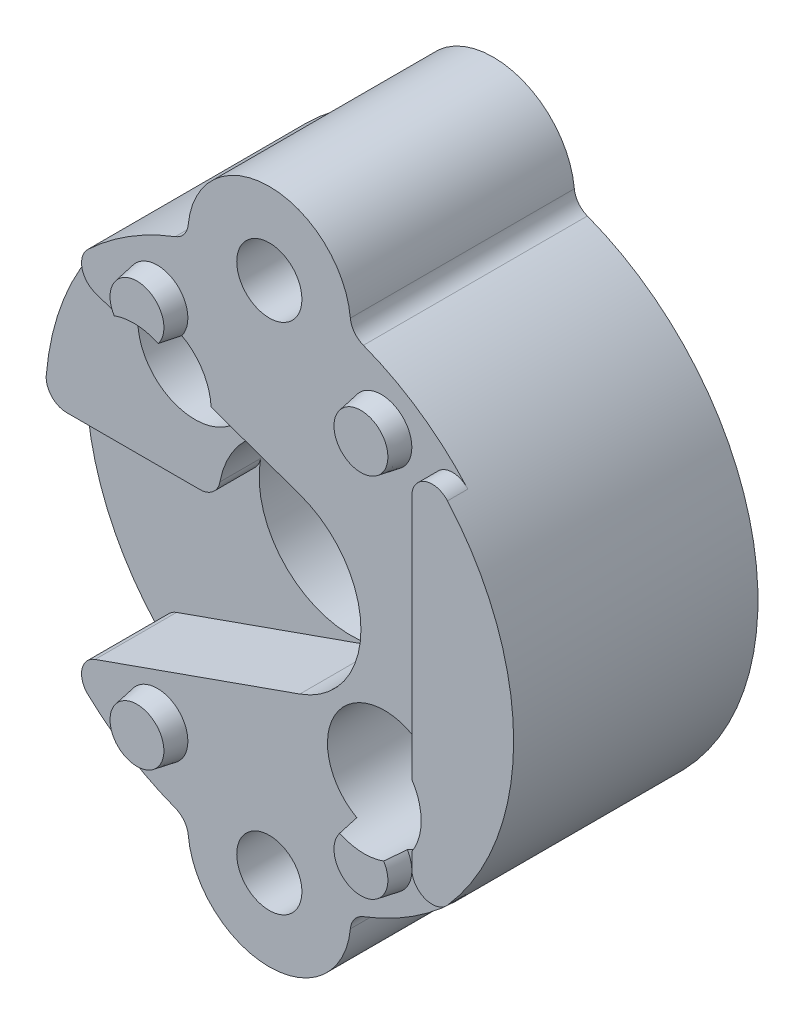
from build123d import *

# Parameters (mm, degrees)
SKETCH1_R                     = 4.5
BOSS_EXTRUDE1_DEPTH           = 11
CUT_EXTRUDE1_START            = -2
CUT_EXTRUDE1_DEPTH            = 2
SKETCH3_R                     = 1.4999999999999996
BOSS_EXTRUDE2_DEPTH           = 1
BOSS_EXTRUDE2_DRAFT           = 10.000000000000021
BOSS_EXTRUDE2_PROFILE_2_DEPTH = 1
BOSS_EXTRUDE2_PROFILE_2_DRAFT = 10.000000000000021
BOSS_EXTRUDE2_PROFILE_3_DEPTH = 1
BOSS_EXTRUDE2_PROFILE_3_DRAFT = 10.000000000000021
SKETCH3_R_2                   = 1.5000000000000002
BOSS_EXTRUDE2_PROFILE_4_DEPTH = 1
BOSS_EXTRUDE2_PROFILE_4_DRAFT = 10.000000000000021
SKETCH4_R                     = 1.5999999999999999
CUT_EXTRUDE2_DEPTH            = 24.7815054191277
CUT_EXTRUDE3_DEPTH            = 24.7815054191277
CUT_EXTRUDE3_DEPTH_BACK       = 5
SKETCH5_R                     = 2.7999999999999994
SKETCH5_R_2                   = 2.8
CUT_EXTRUDE4_DEPTH            = 3
CUT_EXTRUDE5_START            = -2
CUT_EXTRUDE5_DEPTH            = 2
BOSS_EXTRUDE3_DEPTH           = 1
CUT_EXTRUDE6_DEPTH            = 1
FILLET1_R                     = 1
CUT_EXTRUDE7_DEPTH            = 2


with BuildPart() as part:
    # Sketch1 → Boss-Extrude1 (new body)
    with BuildSketch(Plane.XY):
        with BuildLine():
            ThreePointArc((3.993464047921404, -12.371428571428574), (13.000000000000002, 0), (3.9934640479214014, 12.371428571428574))
            ThreePointArc((3.9934640479214014, 12.371428571428574), (2.9081167199998763, 15.346426249302382), (-4.07e-15, 16.6))
            ThreePointArc((-4.07e-15, 16.6), (-2.908116719999883, 15.346426249302382), (-3.9934640479214067, 12.371428571428574))
            ThreePointArc((-3.9934640479214067, 12.371428571428574), (-13.000000000000002, 1.59e-15), (-3.993464047921404, -12.371428571428574))
            ThreePointArc((-3.993464047921404, -12.371428571428574), (-2.90811671999988, -15.346426249302382), (0, -16.6))
            ThreePointArc((0, -16.6), (2.90811671999988, -15.346426249302382), (3.993464047921404, -12.371428571428574))
        make_face()
        Circle(SKETCH1_R, mode=Mode.SUBTRACT)
        with BuildLine():
            ThreePointArc((1.5870475987269075, -12.396825396825397), (4.5e-16, -11), (-1.587047598726907, -12.396825396825397))
            ThreePointArc((-1.587047598726907, -12.396825396825397), (-2.6e-16, -14.2), (1.5870475987269075, -12.396825396825397))
        make_face(mode=Mode.SUBTRACT)
        with BuildLine():
            ThreePointArc((-1.5870475987270802, 12.396825396825376), (-4.89e-15, 10.99999999999983), (1.5870475987267345, 12.396825396825419))
            ThreePointArc((1.5870475987267345, 12.396825396825419), (-2.28e-15, 14.199999999999829), (-1.5870475987270802, 12.396825396825376))
        make_face(mode=Mode.SUBTRACT)
    extrude(amount=BOSS_EXTRUDE1_DEPTH)

    # Sketch2 → Cut-Extrude1 (cut)
    with BuildSketch(Plane.XY.offset(11).offset(CUT_EXTRUDE1_START)):
        with BuildLine():
            Line((-9.998792207106897, -8.30807765966944), (1.5, -4.242640687119285))
            Line((1.5, -4.242640687119285), (1.5, 4.242640687119285))
            Line((1.5, 4.242640687119285), (-9.998792207106897, 8.30807765966944))
            ThreePointArc((-9.998792207106897, 8.30807765966944), (-13.000000000000002, 1.59e-15), (-9.998792207106897, -8.30807765966944))
        make_face()
    extrude(amount=CUT_EXTRUDE1_DEPTH, mode=Mode.SUBTRACT)


with BuildPart() as boss_extrude2_tool:
    # Sketch3 → Boss-Extrude2 (with draft: the straight prism first)
    with BuildSketch(Plane.XY.offset(11)):
        with Locations((-5.5, -9)):
            Circle(SKETCH3_R)
    extrude(amount=BOSS_EXTRUDE2_DEPTH)
    # Boss-Extrude2: the draft: its side faces are tilted about the plane it starts from
    boss_extrude2_sides = [boss_extrude2_tool.faces().sort_by_distance(p)[0] for p in [
        (-7, -9, 11.5),
    ]]
    draft(boss_extrude2_sides, Plane.XY.offset(11), BOSS_EXTRUDE2_DRAFT)


with BuildPart() as part_1:
    add(part.part)

    # Boss-Extrude2: add boss_extrude2_tool
    add(boss_extrude2_tool.part)


with BuildPart() as boss_extrude2_profile_2_tool:
    # Sketch3 → Boss-Extrude2 profile 2 (with draft: the straight prism first)
    with BuildSketch(Plane.XY.offset(11)):
        with Locations((5.5, -9)):
            Circle(SKETCH3_R)
    extrude(amount=BOSS_EXTRUDE2_PROFILE_2_DEPTH)
    # Boss-Extrude2 profile 2: the draft: its side faces are tilted about the plane it starts from
    boss_extrude2_profile_2_sides = [boss_extrude2_profile_2_tool.faces().sort_by_distance(p)[0] for p in [
        (4, -9, 11.5),
    ]]
    draft(boss_extrude2_profile_2_sides, Plane.XY.offset(11), BOSS_EXTRUDE2_PROFILE_2_DRAFT)


with BuildPart() as part_2:
    add(part_1.part)

    # Boss-Extrude2 profile 2: add boss_extrude2_profile_2_tool
    add(boss_extrude2_profile_2_tool.part)


with BuildPart() as boss_extrude2_profile_3_tool:
    # Sketch3 → Boss-Extrude2 profile 3 (with draft: the straight prism first)
    with BuildSketch(Plane.XY.offset(11)):
        with Locations((5.499999999999998, 9)):
            Circle(SKETCH3_R)
    extrude(amount=BOSS_EXTRUDE2_PROFILE_3_DEPTH)
    # Boss-Extrude2 profile 3: the draft: its side faces are tilted about the plane it starts from
    boss_extrude2_profile_3_sides = [boss_extrude2_profile_3_tool.faces().sort_by_distance(p)[0] for p in [
        (4, 9, 11.5),
    ]]
    draft(boss_extrude2_profile_3_sides, Plane.XY.offset(11), BOSS_EXTRUDE2_PROFILE_3_DRAFT)


with BuildPart() as part_3:
    add(part_2.part)

    # Boss-Extrude2 profile 3: add boss_extrude2_profile_3_tool
    add(boss_extrude2_profile_3_tool.part)


with BuildPart() as boss_extrude2_profile_4_tool:
    # Sketch3 → Boss-Extrude2 profile 4 (with draft: the straight prism first)
    with BuildSketch(Plane.XY.offset(11)):
        with Locations((-5.500000000000003, 9)):
            Circle(SKETCH3_R_2)
    extrude(amount=BOSS_EXTRUDE2_PROFILE_4_DEPTH)
    # Boss-Extrude2 profile 4: the draft: its side faces are tilted about the plane it starts from
    boss_extrude2_profile_4_sides = [boss_extrude2_profile_4_tool.faces().sort_by_distance(p)[0] for p in [
        (-7, 9, 11.5),
    ]]
    draft(boss_extrude2_profile_4_sides, Plane.XY.offset(11), BOSS_EXTRUDE2_PROFILE_4_DRAFT)


with BuildPart() as part_4:
    add(part_3.part)

    # Boss-Extrude2 profile 4: add boss_extrude2_profile_4_tool
    add(boss_extrude2_profile_4_tool.part)

    # Sketch4 → Cut-Extrude2 (cut, through all)
    with BuildSketch(Plane.XY.offset(11)):
        with Locations((5.65685424949239, -5.656854249492369)):
            Circle(SKETCH4_R)
        with Locations((-5.65685424949239, 5.656854249492373)):
            Circle(SKETCH4_R)
    extrude(amount=-CUT_EXTRUDE2_DEPTH, mode=Mode.SUBTRACT)

    # Sketch5 → Cut-Extrude3 (cut, two sides: drawn at the far end of the back side and taken through both)
    with BuildSketch(Plane.XY.offset(11).offset(-CUT_EXTRUDE3_DEPTH_BACK)):
        with Locations(Location((5.65685424949239, -5.656854249492369, 0), (0, 0, 240.938574299))):
            Circle(SKETCH5_R)
        with Locations(Location((-5.656854249492392, 5.656854249492367, 0), (0, 0, 138.454024878))):
            Circle(SKETCH5_R_2)
    extrude(amount=CUT_EXTRUDE3_DEPTH + CUT_EXTRUDE3_DEPTH_BACK, mode=Mode.SUBTRACT)

    # Sketch6 → Cut-Extrude4 (cut)
    with BuildSketch(Plane(origin=(0, 0, 0), x_dir=(-1, 0, 0), z_dir=(0, 0, -1))):
        Polygon((9.73e-15, 9.366838492538095), (2.800000000000004, 10.983419246269044), (2.800000000000004, 14.216580753730957), (1.041e-14, 15.833161507461904), (-2.7999999999999936, 14.21658075373095), (-2.7999999999999936, 10.98341924626905), align=None)
        Polygon((8.7e-16, -9.366838492538093), (-2.7999999999999994, -10.983419246269044), (-2.7999999999999994, -14.216580753730952), (-7.6e-16, -15.833161507461904), (2.7999999999999994, -14.216580753730952), (2.8000000000000003, -10.983419246269046), align=None)
    extrude(amount=-CUT_EXTRUDE4_DEPTH, mode=Mode.SUBTRACT)

    # Sketch7 → Cut-Extrude5 (cut)
    with BuildSketch(Plane.XY.offset(9).offset(CUT_EXTRUDE5_START)):
        with BuildLine():
            Line((-4.5, 5.5e-16), (-13.000000000000004, 1.59e-15))
            ThreePointArc((-13.000000000000004, 1.59e-15), (-12.226698219314768, -4.4167692552141835), (-9.998792207106897, -8.30807765966944))
            Line((-9.998792207106897, -8.30807765966944), (1.4999999999999987, -4.242640687119285))
            ThreePointArc((1.4999999999999987, -4.242640687119285), (-2.598076211353315, -3.6742346141747677), (-4.5, 5.5e-16))
        make_face()
    extrude(amount=CUT_EXTRUDE5_DEPTH, mode=Mode.SUBTRACT)

    # Sketch8 → Boss-Extrude3 (add)
    with BuildSketch(Plane.XY.offset(11)):
        with BuildLine():
            Line((8.000000000000002, 10.2469507659596), (8.000000000000002, -4.123991570751015))
            ThreePointArc((8.000000000000002, -4.123991570751015), (8.456854249492391, -5.656854249492369), (8.000000000000002, -7.189716928233723))
            Line((8.000000000000002, -7.189716928233723), (8.000000000000002, -10.2469507659596))
            ThreePointArc((8.000000000000002, -10.2469507659596), (13.000000000000002, 0), (8.000000000000002, 10.2469507659596))
        make_face()
    extrude(amount=BOSS_EXTRUDE3_DEPTH)

    # Sketch9 → Cut-Extrude6 (cut)
    with BuildSketch(Plane(origin=(0, 0, 0), x_dir=(-1, 0, 0), z_dir=(0, 0, -1))):
        with BuildLine():
            Line((5.740316883347941, -7.154530445721011), (8.45804460872515, -9.87225817109821))
            ThreePointArc((8.45804460872515, -9.87225817109821), (9.192388155425135, -9.192388155425098), (9.872258171098244, -8.458044608725112))
            Line((9.872258171098244, -8.458044608725112), (7.154530445721033, -5.740316883347915))
            ThreePointArc((7.154530445721033, -5.740316883347915), (4.596194077712568, -4.59619407771255), (5.740316883347941, -7.154530445721011))
        make_face()
    extrude(amount=-CUT_EXTRUDE6_DEPTH, mode=Mode.SUBTRACT)

    # Fillet1
    fillet1_edges = [part_4.edges().sort_by_distance(p)[0] for p in [
        (-3.993464047921405, -12.371428571428574, 5.5),
        (-3.9934640479214067, 12.371428571428574, 5.5),
        (3.9934640479214023, 12.371428571428574, 5.5),
        (3.9934640479214036, -12.371428571428574, 5.5),
        (-4.5, 7.8e-16, 8),
        (-13.000000000000005, 1.59e-15, 8),
        (8.000000000000002, -10.2469507659596, 11.5),
        (8.000000000000002, 10.2469507659596, 11.5),
        (-5.7403168833479405, -7.1545304457210115, 0.5),
        (-7.154530445721033, -5.740316883347915, 0.5),
        (-9.998792207106899, -8.30807765966944, 9),
        (-9.998792207106895, 8.30807765966944, 10),
    ]]
    fillet(fillet1_edges, radius=FILLET1_R)

    # Sketch10 → Cut-Extrude7 (cut)
    with BuildSketch(Plane(origin=(0, 0, 0), x_dir=(-1, 0, 0), z_dir=(0, 0, -1))):
        with BuildLine():
            Line((5.500000000000001, 3.7527767497325657), (7.058845726811989, 2.8527767497325622))
            ThreePointArc((7.058845726811989, 2.8527767497325622), (7.424871130596426, 1.4867513459481236), (6.058845726811987, 1.120725942163687))
            Line((6.058845726811987, 1.120725942163687), (4.499999999999998, 2.0207259421636885))
            ThreePointArc((4.499999999999998, 2.0207259421636885), (4.13397459621556, 3.3867513459481287), (5.500000000000001, 3.7527767497325657))
        make_face()
    extrude(amount=-CUT_EXTRUDE7_DEPTH, mode=Mode.SUBTRACT)


solid = part_4.part
